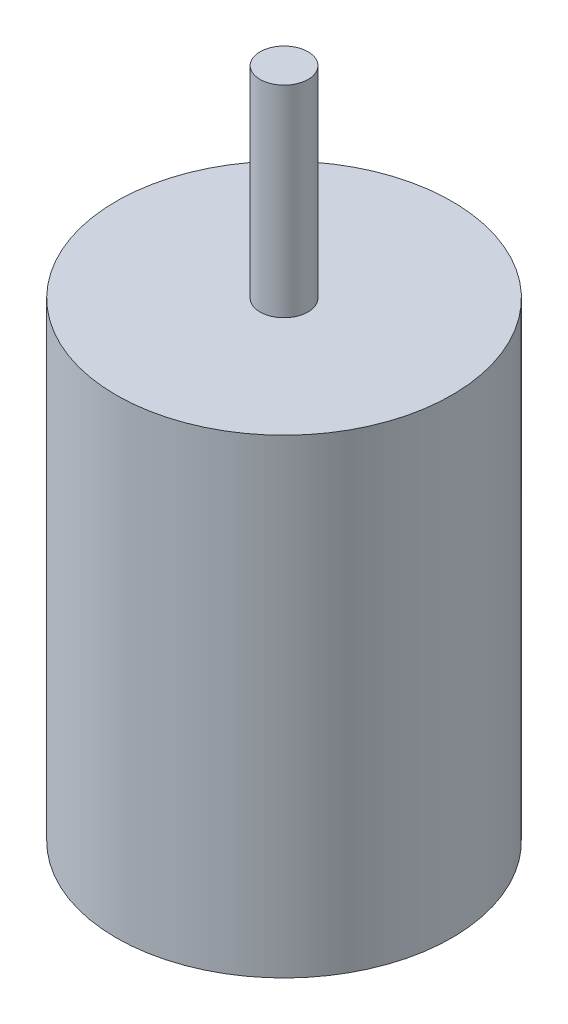
from build123d import *

# Parameters (mm, degrees)
SKETCH1_R           = 2.5
BOSS_EXTRUDE1_DEPTH = 70
SKETCH2_R           = 17.5
BOSS_EXTRUDE2_DEPTH = 49


with BuildPart() as part:
    # Sketch1 → Boss-Extrude1 (new body)
    with BuildSketch(Plane(origin=(0, 0, 0), x_dir=(1, 0, 0), z_dir=(0, 1, 0))):
        with Locations(Location((0, 0, 0), (0, 0, 270))):
            Circle(SKETCH1_R)
    extrude(amount=BOSS_EXTRUDE1_DEPTH)

    # Sketch2 → Boss-Extrude2 (add)
    with BuildSketch(Plane(origin=(0, 0, 0), x_dir=(1, 0, 0), z_dir=(0, 1, 0))):
        with Locations(Location((0, 0, 0), (0, 0, 270))):
            Circle(SKETCH2_R)
    extrude(amount=BOSS_EXTRUDE2_DEPTH)


solid = part.part
